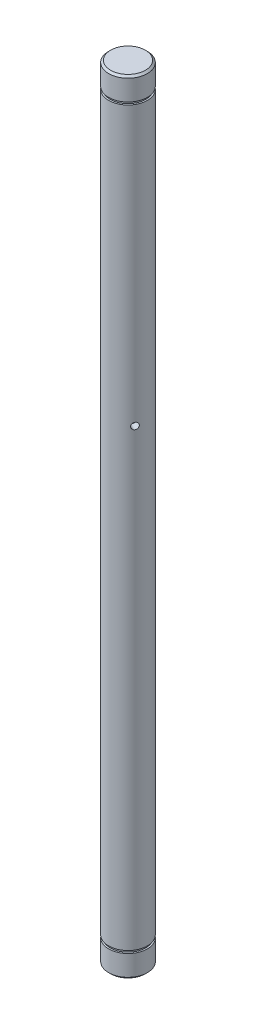
from build123d import *

# Parameters (mm, degrees)
SCHIZZO1_R                  = 30
ESTRUSIONE1_DEPTH           = 1136
SCHIZZO2_R                  = 27.5
ESTRUSIONE2_DEPTH           = 4
SCHIZZO3_R                  = 30
ESTRUSIONE3_DEPTH           = 35
SMUSSO1_SIZE                = 3
ESTRUSIONE4_START           = 4
SCHIZZO4_R                  = 27.5
ESTRUSIONE4_DEPTH           = 4
ESTRUSIONE5_START           = 35
SCHIZZO5_R                  = 30
ESTRUSIONE5_DEPTH           = 35
SMUSSO2_SIZE                = 3
ESTRUSIONE6_START           = -18
SCHIZZO6_R                  = 5
ESTRUSIONE6_DEPTH           = 1158.765707954
RIPETIZIONECIRCOLARE1_COUNT = 3


with BuildPart() as part:
    # Schizzo1 → Estrusione1 (new body)
    with BuildSketch(Plane(origin=(0, 0, 0), x_dir=(1, 0, 0), z_dir=(0, 1, 0))):
        Circle(SCHIZZO1_R)
    extrude(amount=ESTRUSIONE1_DEPTH)

    # Schizzo2 → Estrusione2 (add)
    with BuildSketch(Plane(origin=(0, 1136, 0), x_dir=(1, 0, 0), z_dir=(0, 1, 0))):
        Circle(SCHIZZO2_R)
    extrude(amount=ESTRUSIONE2_DEPTH)

    # Schizzo3 → Estrusione3 (add)
    with BuildSketch(Plane(origin=(0, 1140, 0), x_dir=(1, 0, 0), z_dir=(0, 1, 0))):
        Circle(SCHIZZO3_R)
    extrude(amount=ESTRUSIONE3_DEPTH)

    # Smusso1
    smusso1_edges = [part.edges().sort_by_distance(p)[0] for p in [
        (-30, 1175, 0),
    ]]
    chamfer(smusso1_edges, length=SMUSSO1_SIZE)

    # Schizzo4 → Estrusione4 (add)
    with BuildSketch(Plane.XZ.offset(ESTRUSIONE4_START)):
        Circle(SCHIZZO4_R)
    extrude(amount=-ESTRUSIONE4_DEPTH)

    # Schizzo5 → Estrusione5 (add)
    with BuildSketch(Plane.XZ.offset(4).offset(ESTRUSIONE5_START)):
        Circle(SCHIZZO5_R)
    extrude(amount=-ESTRUSIONE5_DEPTH)

    # Smusso2
    smusso2_edges = [part.edges().sort_by_distance(p)[0] for p in [
        (-30, -39, 0),
    ]]
    chamfer(smusso2_edges, length=SMUSSO2_SIZE)

    # Schizzo6 → Estrusione6 (cut, through all)
    with BuildSketch(Plane.XY.offset(ESTRUSIONE6_START)):
        with Locations((0, 704)):
            Circle(SCHIZZO6_R)
    estrusione6 = extrude(amount=-ESTRUSIONE6_DEPTH, mode=Mode.SUBTRACT)

    # RipetizioneCircolare1: Estrusione6 ×3 about axis
    ripetizionecircolare1_axis = Axis((0, 1136, 0), (0, -1, 0))
    for i in range(1, RIPETIZIONECIRCOLARE1_COUNT):
        add(estrusione6.rotate(ripetizionecircolare1_axis, i * 360 / RIPETIZIONECIRCOLARE1_COUNT), mode=Mode.SUBTRACT)


solid = part.part
